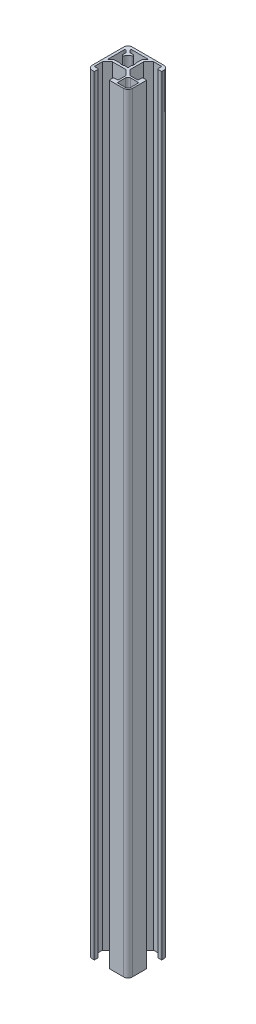
from build123d import *

# Parameters (mm, degrees)
AUFSATZ_LINEAR_AUSTRAGEN1_DEPTH = 440


with BuildPart() as part:
    # Skizze1 → Aufsatz-Linear austragen1 (new body)
    with BuildSketch(Plane.XZ):
        with BuildLine():
            Line((3.450001515, 23.00000001), (2.5, 23.00000001))
            ThreePointArc((2.5, 23.00000001), (0.73223304, 22.26776696), (-1e-08, 20.5))
            Line((-1e-08, 20.5), (-1e-08, 2.50000002))
            ThreePointArc((-1e-08, 2.50000002), (0.732233039, 0.732233062), (2.499999998, 1.2e-08))
            Line((2.499999998, 1.2e-08), (20.499999977, 1.2e-08))
            ThreePointArc((20.499999977, 1.2e-08), (22.267766938, 0.732233062), (22.999999988, 2.500000023))
            Line((22.999999988, 2.500000023), (22.999999988, 3.450004181))
            ThreePointArc((22.999999988, 3.450004181), (22.912132793, 3.662134355), (22.700002619, 3.75000155))
            Line((22.700002619, 3.75000155), (20.999999992, 3.75000155))
            ThreePointArc((20.999999992, 3.75000155), (20.6464466, 3.60355494), (20.49999999, 3.250001548))
            Line((20.49999999, 3.250001548), (20.49999999, 1.500001969))
            ThreePointArc((20.49999999, 1.500001969), (20.412132795, 1.287871795), (20.200002621, 1.2000046))
            Line((20.200002621, 1.2000046), (15.86065559, 1.2000046))
            Line((15.86065559, 1.2000046), (12.99999999, 4.0606602))
            Line((12.99999999, 4.0606602), (12.99999999, 11.93933984))
            Line((12.99999999, 11.93933984), (15.86065559, 14.79999544))
            Line((15.86065559, 14.79999544), (20.200002638, 14.79999544))
            ThreePointArc((20.200002638, 14.79999544), (20.4121328, 14.71212825), (20.49999999, 14.499998088))
            Line((20.49999999, 14.499998088), (20.49999999, 12.749998492))
            ThreePointArc((20.49999999, 12.749998492), (20.6464466, 12.3964451), (20.999999992, 12.24999849))
            Line((20.999999992, 12.24999849), (22.700002636, 12.24999849))
            ThreePointArc((22.700002636, 12.24999849), (22.912132798, 12.33786568), (22.999999988, 12.549995842))
            Line((22.999999988, 12.549995842), (22.999999988, 20.5))
            ThreePointArc((22.999999988, 20.5), (22.267766938, 22.26776696), (20.499999977, 23.00000001))
            Line((20.499999977, 23.00000001), (12.549998485, 23.00000001))
            ThreePointArc((12.549998485, 23.00000001), (12.33786644, 22.91213204), (12.24999847, 22.699999995))
            Line((12.24999847, 22.699999995), (12.24999847, 21.000000012))
            ThreePointArc((12.24999847, 21.000000012), (12.39644508, 20.64644662), (12.749998472, 20.50000001))
            Line((12.749998472, 20.50000001), (14.499998051, 20.50000001))
            ThreePointArc((14.499998051, 20.50000001), (14.712128225, 20.412132815), (14.79999542, 20.200002641))
            Line((14.79999542, 20.200002641), (14.79999542, 15.86065561))
            Line((14.79999542, 15.86065561), (11.93933982, 13.00000001))
            Line((11.93933982, 13.00000001), (4.06066018, 13.00000001))
            Line((4.06066018, 13.00000001), (1.20000458, 15.86065561))
            Line((1.20000458, 15.86065561), (1.20000458, 20.200002658))
            ThreePointArc((1.20000458, 20.200002658), (1.28787177, 20.41213282), (1.500001932, 20.50000001))
            Line((1.500001932, 20.50000001), (3.250001528, 20.50000001))
            ThreePointArc((3.250001528, 20.50000001), (3.60355492, 20.64644662), (3.75000153, 21.000000012))
            Line((3.75000153, 21.000000012), (3.75000153, 22.699999995))
            ThreePointArc((3.75000153, 22.699999995), (3.66213356, 22.91213204), (3.450001515, 23.00000001))
        make_face()
        with BuildLine():
            Line((1.49999999, 3.767766952), (1.49999999, 12.715075784))
            ThreePointArc((1.49999999, 12.715075784), (1.685194957, 12.992239639), (2.012132015, 12.927207815))
            Line((2.012132015, 12.927207815), (3.146446603, 11.792893227))
            ThreePointArc((3.146446603, 11.792893227), (3.470869961, 11.57612047), (3.853553404, 11.5))
            Line((3.853553404, 11.5), (5.91421356, 11.5))
            Line((5.91421356, 11.5), (5.994865994, 11.419347566))
            ThreePointArc((5.994865994, 11.419347566), (6.158199998, 11.33547495), (6.339812993, 11.362481111))
            ThreePointArc((6.339812993, 11.362481111), (7.999999982, 11.750000011), (9.660186973, 11.362481114))
            ThreePointArc((9.660186973, 11.362481114), (9.841799967, 11.335474953), (10.00513397, 11.419347568))
            Line((10.00513397, 11.419347568), (10.085786402, 11.5))
            Line((10.085786402, 11.5), (10.999999968, 11.5))
            ThreePointArc((10.999999968, 11.5), (11.35355336, 11.35355339), (11.49999997, 10.999999998))
            Line((11.49999997, 10.999999998), (11.49999997, 10.085786456))
            Line((11.49999997, 10.085786456), (11.41934753, 10.005134016))
            ThreePointArc((11.41934753, 10.005134016), (11.335474915, 9.841800012), (11.362481077, 9.660187017))
            ThreePointArc((11.362481077, 9.660187017), (11.749999981, 8.00000002), (11.362481081, 6.339813023))
            ThreePointArc((11.362481081, 6.339813023), (11.33547492, 6.158200028), (11.419347536, 5.994866024))
            Line((11.419347536, 5.994866024), (11.49999997, 5.91421359))
            Line((11.49999997, 5.91421359), (11.49999997, 3.853553434))
            ThreePointArc((11.49999997, 3.853553434), (11.57612044, 3.470869991), (11.792893197, 3.146446633))
            Line((11.792893197, 3.146446633), (12.927207774, 2.012132056))
            ThreePointArc((12.927207774, 2.012132056), (12.992239599, 1.685194995), (12.715075743, 1.500000027))
            Line((12.715075743, 1.500000027), (3.767766925, 1.500000027))
            ThreePointArc((3.767766925, 1.500000027), (3.305827172, 1.808658302), (3.414213544, 2.353553394))
            Line((3.414213544, 2.353553394), (4.41421357, 3.35355342))
            ThreePointArc((4.41421357, 3.35355342), (4.576425223, 3.461939781), (4.767766914, 3.50000001))
            Line((4.767766914, 3.50000001), (6.563859334, 3.50000001))
            ThreePointArc((6.563859334, 3.50000001), (7.05645152, 3.91425072), (6.732817059, 4.47058825))
            ThreePointArc((6.732817059, 4.47058825), (5.348349567, 5.348349579), (4.470588229, 6.732817064))
            ThreePointArc((4.470588229, 6.732817064), (3.914250698, 7.056451522), (3.49999999, 6.563859337))
            Line((3.49999999, 6.563859337), (3.49999999, 4.767766934))
            ThreePointArc((3.49999999, 4.767766934), (3.461939761, 4.576425243), (3.3535534, 4.41421359))
            Line((3.3535534, 4.41421359), (2.353553374, 3.414213564))
            ThreePointArc((2.353553374, 3.414213564), (1.808658272, 3.305827189), (1.49999999, 3.767766952))
        make_face(mode=Mode.SUBTRACT)
        with BuildLine():
            Line((15.79999543, 17.299995436), (15.79999543, 21.499999998))
            ThreePointArc((15.79999543, 21.499999998), (15.94644204, 21.85355339), (16.299995432, 22))
            Line((16.299995432, 22), (20.499999977, 22))
            ThreePointArc((20.499999977, 22), (21.560660149, 21.560660172), (21.999999978, 20.5))
            Line((21.999999978, 20.5), (21.999999978, 16.299995432))
            ThreePointArc((21.999999978, 16.299995432), (21.853553368, 15.94644204), (21.499999976, 15.79999543))
            Line((21.499999976, 15.79999543), (17.299995436, 15.79999543))
            ThreePointArc((17.299995436, 15.79999543), (16.23933526, 16.23933526), (15.79999543, 17.299995436))
        make_face(mode=Mode.SUBTRACT)
    extrude(amount=-AUFSATZ_LINEAR_AUSTRAGEN1_DEPTH)


solid = part.part
